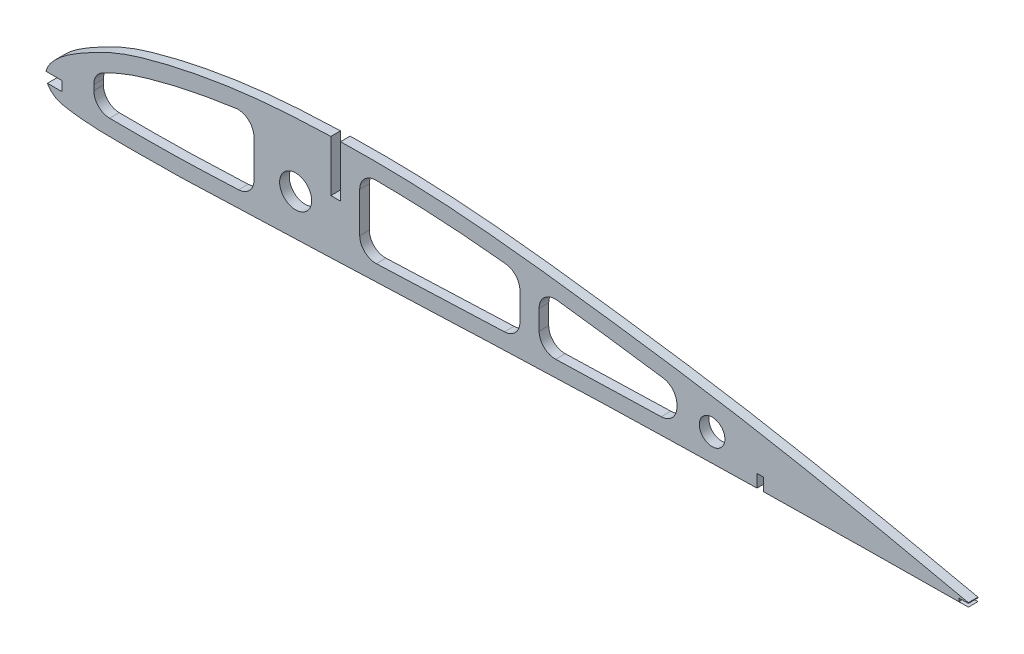
from build123d import *

# Parameters (mm, degrees)
SKETCH_1_R          = 5
SKETCH_1_R_2        = 4
EXTRUDE_1_DEPTH     = 3
CUT_EXTRUDE_2_DEPTH = 291.422386836


with BuildPart() as part:
    # 草图1 → 凸台-拉伸1 (new body)
    with BuildSketch(Plane.XY):
        with BuildLine():
            Line((90, 12.3715), (90, 28.372426217))
            add(Edge.make_bspline(
                [(90, 28.372426217), (89.259446982, 28.350928743), (82.363996343, 28.13322439), (72.403347361, 27.586524792), (60.185862052, 26.226268085), (51.080991088, 24.79810862), (42.033943524, 23.000087944), (34.581994337, 21.174922903), (28.697351661, 19.44563851), (24.361981086, 17.983441115), (20.174828998, 16.207949367), (16.078941989, 14.139912989), (12.040296713, 11.946766626), (8.14011433, 9.56039573), (5.153679337, 7.316395724), (3.100060439, 5.200618052), (1.813825976, 3.470730924), (1.237398467, 2.180506339), (1.085380705, 1.529058937), (1.078882286, 1.5)],
                knots=[0.345773533, 0.345773533, 0.345773533, 0.345773533, 0.349398211, 0.379527288, 0.394591827, 0.409656366, 0.424720905, 0.439785444, 0.447317713, 0.454849983, 0.462382252, 0.469914522, 0.477446791, 0.484979061, 0.49251133, 0.496277465, 0.5000436, 0.503809734, 0.503985678, 0.503985678, 0.503985678, 0.503985678], degree=3))
            Line((1.078882286, 1.5), (6, 1.5))
            Line((6, 1.5), (6, -1.5))
            Line((6, -1.5), (1.522379628, -1.5))
            add(Edge.make_bspline(
                [(1.522379628, -1.5), (1.617903461, -1.678770523), (2.068186491, -2.42442122), (3.143139608, -3.601090845), (4.854253, -4.619355756), (6.927567017, -5.105597911), (9.209034621, -5.454839075), (12.219971865, -5.84289763), (16.020132359, -6.14266222), (20.609524976, -6.2611368), (25.231457517, -6.286948592), (31.397380169, -6.280305851), (39.107274969, -6.240736398), (48.336813051, -6.022096429), (57.579935967, -5.612990736), (66.840654471, -5.242934226), (76.096556555, -4.921715721), (88.435998513, -4.515955408), (103.853120896, -3.973102953), (122.354625015, -3.248110744), (140.857835973, -2.495489966), (159.368527813, -1.804089638), (177.884173919, -1.222493213), (196.4033921, -0.774877257), (211.439290174, -0.454334834), (220.305576898, -0.265987383), (223, -0.210849605)],
                knots=[0.510182255, 0.510182255, 0.510182255, 0.510182255, 0.511342004, 0.515108139, 0.518874273, 0.522640408, 0.526406543, 0.530172677, 0.537704947, 0.545237216, 0.552769486, 0.560301755, 0.575366294, 0.590430833, 0.605495372, 0.620559911, 0.63562445, 0.650688989, 0.680818067, 0.710947144, 0.741076222, 0.7712053, 0.801334378, 0.831463456, 0.861592533, 0.874744372, 0.874744372, 0.874744372, 0.874744372], degree=3))
            Line((223, -0.210849605), (223, 3.788737263))
            Line((223, 3.788737263), (225, 3.788737263))
            Line((225, 3.788737263), (225, -0.170338801))
            add(Edge.make_bspline(
                [(225, -0.170338801), (227.811595191, -0.114017747), (236.796798206, 0.056910764), (251.961175933, 0.256656825), (270.471854229, 0.429163033), (282.824771355, 0.587434741), (289, 0.610062865)],
                knots=[0.877998396, 0.877998396, 0.877998396, 0.877998396, 0.891721611, 0.921850689, 0.951979767, 0.982108845, 0.982108845, 0.982108845, 0.982108845], degree=3))
            Line((289, 0.610062865), (286, 0.610062865))
            Line((286, 0.610062865), (286, 1.610062865))
            Line((286, 1.610062865), (289, 1.610062865))
            Line((289, 1.610062865), (289, 1.816246039))
            add(Edge.make_bspline(
                [(289, 1.816246039), (276.957314444, 4.502285023), (258.861554155, 8.397620333), (234.648247971, 13.152786595), (216.448478593, 16.478914183), (198.182873559, 19.371550405), (179.850571346, 21.924148488), (161.503162682, 24.358614825), (143.127892269, 26.473190985), (124.712239059, 28.043780086), (107.994173705, 28.616385423), (97.416270032, 28.546670082), (93, 28.44913561)],
                knots=[0.017978355, 0.017978355, 0.017978355, 0.017978355, 0.07823651, 0.108365588, 0.138494666, 0.168623744, 0.198752821, 0.228881899, 0.259010977, 0.289140055, 0.319269133, 0.340879606, 0.340879606, 0.340879606, 0.340879606], degree=3))
            Line((93, 28.44913561), (93, 12.3715))
            Line((93, 12.3715), (90, 12.3715))
        make_face()
        with Locations((79, 8)):
            Circle(SKETCH_1_R, mode=Mode.SUBTRACT)
        with Locations((209, 8)):
            Circle(SKETCH_1_R_2, mode=Mode.SUBTRACT)
    extrude(amount=EXTRUDE_1_DEPTH)

    # 草图3 → 切除-拉伸2 (cut, through all)
    with BuildSketch(Plane.XY):
        with BuildLine():
            Line((16, 5.402967421), (16, 3.749585631))
            ThreePointArc((16, 3.749585631), (17.438635496, 0.240072435), (20.926673148, -1.249876658))
            add(Edge.make_bspline(
                [(20.926673148, -1.249876658), (21.809693827, -1.262827876), (22.70041751, -1.270722289), (24.744752026, -1.282014543), (25.903390676, -1.283802206), (29.38108188, -1.283541675), (31.709604831, -1.277171959), (36.343989553, -1.248263334), (38.652190318, -1.223511787), (43.261210505, -1.138923387), (45.563329713, -1.080117385), (50.168153725, -0.92677743), (52.481550313, -0.831144642), (56.932408226, -0.642663317), (59.067384965, -0.552312083), (61.201531448, -0.466222597)],
                knots=[0.097228806, 0.097228806, 0.097228806, 0.097228806, 0.109375, 0.109375, 0.125, 0.125, 0.15625, 0.15625, 0.1875, 0.1875, 0.21875, 0.21875, 0.25, 0.25, 0.27850067, 0.27850067, 0.27850067, 0.27850067], degree=3))
            ThreePointArc((61.201531448, -0.466222597), (64.606082169, 1.066165303), (65.999999998, 4.529714259))
            Line((65.999999998, 4.529714259), (65.999999998, 16.175207171))
            ThreePointArc((65.999999998, 16.175207171), (64.287676461, 19.942325894), (60.323526607, 21.129234195))
            add(Edge.make_bspline(
                [(60.323526607, 21.129234195), (59.14328274, 20.968071656), (57.964431767, 20.796736398), (53.109249428, 20.046773379), (49.445857595, 19.384253181), (42.158673028, 17.868714577), (38.533379611, 17.019586343), (33.148990447, 15.546220745), (31.362942012, 15.022439399), (27.821005995, 13.880218625), (26.067238608, 13.253271835), (22.635818059, 11.812670552), (20.957942753, 11.004847704), (19.099592195, 10.049689097), (18.896441621, 9.944700093), (18.693547477, 9.839213217)],
                knots=[0.029920383, 0.029920383, 0.029920383, 0.029920383, 0.033494004, 0.033494004, 0.044658672, 0.044658672, 0.05582334, 0.05582334, 0.061405674, 0.061405674, 0.066988008, 0.066988008, 0.072570342, 0.072570342, 0.073256353, 0.073256353, 0.073256353, 0.073256353], degree=3))
            ThreePointArc((18.693547477, 9.839213217), (16.726110517, 7.997937304), (16, 5.402967421))
        make_face()
        with BuildLine():
            Line((99, 18.545958183), (99, 6.051698891))
            ThreePointArc((99, 6.051698891), (100.530987404, 2.450872374), (104.186380643, 1.055173873))
            add(Edge.make_bspline(
                [(104.186380643, 1.055173873), (106.39458867, 1.137544567), (108.602901821, 1.221357381), (120.131865001, 1.665786726), (129.456324286, 2.050051394), (140.592579239, 2.48797418), (142.3918285, 2.557905459), (144.191396926, 2.626842357)],
                knots=[0.470377348, 0.470377348, 0.470377348, 0.470377348, 0.5, 0.5, 0.625, 0.625, 0.649081852, 0.649081852, 0.649081852, 0.649081852], degree=3))
            ThreePointArc((144.191396926, 2.626842357), (147.602567462, 4.155973144), (149, 7.623177736))
            Line((149, 7.623177736), (149, 16.241622969))
            ThreePointArc((149, 16.241622969), (147.712532938, 19.59081678), (144.513160327, 21.215219904))
            add(Edge.make_bspline(
                [(144.513160327, 21.215219904), (143.652145828, 21.304056714), (142.791222193, 21.391146352), (137.856440927, 21.879784463), (133.787425472, 22.240923522), (125.659256001, 22.840362063), (121.601588339, 23.075546461), (113.037568805, 23.424275072), (108.53263967, 23.523953165), (104.024339014, 23.545898944)],
                knots=[0.736793621, 0.736793621, 0.736793621, 0.736793621, 0.75, 0.75, 0.8125, 0.8125, 0.875, 0.875, 0.944193059, 0.944193059, 0.944193059, 0.944193059], degree=3))
            ThreePointArc((104.024339014, 23.545898944), (100.473081733, 22.090086783), (99, 18.545958183))
        make_face()
        with BuildLine():
            Line((155, 14.41455393), (155, 8.204846233))
            ThreePointArc((155, 8.204846233), (156.525241738, 4.609563904), (160.17042201, 3.207751443))
            add(Edge.make_bspline(
                [(160.17042201, 3.207751443), (162.389721662, 3.283438922), (164.609319497, 3.356780918), (171.504636491, 3.576232826), (176.18199895, 3.713351663), (184.945921303, 3.946800138), (189.03214497, 4.046860263), (193.116453453, 4.14201244)],
                knots=[0.720326449, 0.720326449, 0.720326449, 0.720326449, 0.75, 0.75, 0.8125, 0.8125, 0.867133534, 0.867133534, 0.867133534, 0.867133534], degree=3))
            ThreePointArc((193.116453453, 4.14201244), (196.576469437, 5.64653729), (198, 9.140656115))
            Line((198, 9.140656115), (198, 9.967295711))
            ThreePointArc((198, 9.967295711), (196.781019979, 13.238975389), (193.718444833, 14.915410202))
            add(Edge.make_bspline(
                [(193.718444833, 14.915410202), (192.779013077, 15.051811632), (191.839123333, 15.187073825), (186.824226186, 15.902901834), (182.740892869, 16.465870736), (174.565909682, 17.575800313), (170.481299177, 18.120965891), (164.469973656, 18.894543341), (162.541485429, 19.138417507), (160.613475955, 19.376775938)],
                knots=[0.485575284, 0.485575284, 0.485575284, 0.485575284, 0.5, 0.5, 0.5625, 0.5625, 0.625, 0.625, 0.654532252, 0.654532252, 0.654532252, 0.654532252], degree=3))
            ThreePointArc((160.613475955, 19.376775938), (156.688458046, 18.160710613), (155, 14.41455393))
        make_face()
    extrude(amount=CUT_EXTRUDE_2_DEPTH, mode=Mode.SUBTRACT)


solid = part.part
